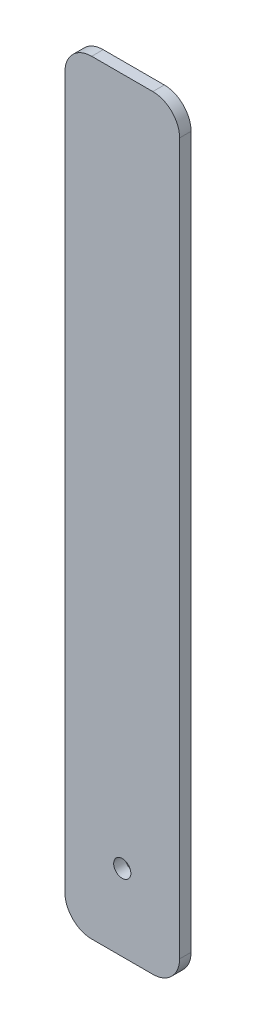
from build123d import *

# Parameters (mm, degrees)
SKETCH2_R           = 2.25
BOSS_EXTRUDE1_DEPTH = 3


with BuildPart() as part:
    # Sketch2 → Boss-Extrude1 (new body)
    with BuildSketch(Plane.XY):
        with BuildLine():
            Line((8, -100), (-8, -100))
            ThreePointArc((-8, -100), (-12.949747468, -97.949747468), (-15, -93))
            Line((-15, -93), (-15, 93))
            ThreePointArc((-15, 93), (-12.949747468, 97.949747468), (-8, 100))
            Line((-8, 100), (8, 100))
            ThreePointArc((8, 100), (12.949747468, 97.949747468), (15, 93))
            Line((15, 93), (15, -93))
            ThreePointArc((15, -93), (12.949747468, -97.949747468), (8, -100))
        make_face()
        with Locations((0, -80)):
            Circle(SKETCH2_R, mode=Mode.SUBTRACT)
    extrude(amount=BOSS_EXTRUDE1_DEPTH)


solid = part.part
